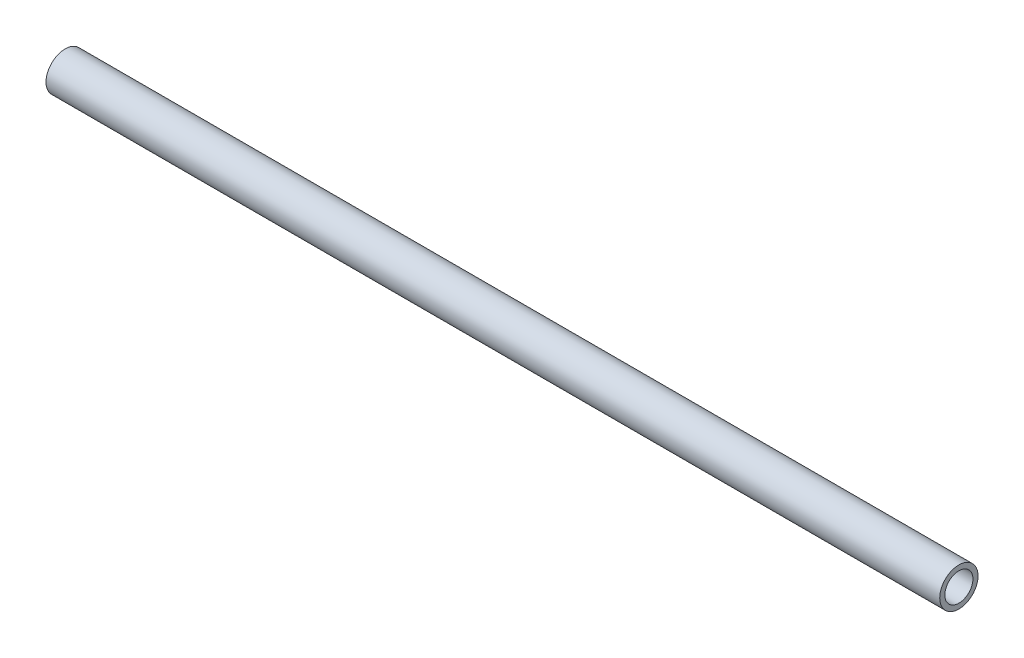
from build123d import *

# Parameters (mm, degrees)
AXIAL_PROFILE_MM_W = 105
AXIAL_PROFILE_MM_H = 0.6


with BuildPart() as part:
    # Axial profile (mm) → Full revolution (revolve)
    with BuildSketch(Plane.XY, mode=Mode.PRIVATE) as full_revolution_sk:
        with Locations((66.2, 1.95)):
            Rectangle(AXIAL_PROFILE_MM_W, AXIAL_PROFILE_MM_H)
    revolve(full_revolution_sk.sketch.rotate(Axis((-110, 0, 0), (1, 0, 0)), 90), axis=Axis((-110, 0, 0), (1, 0, 0)))


solid = part.part
